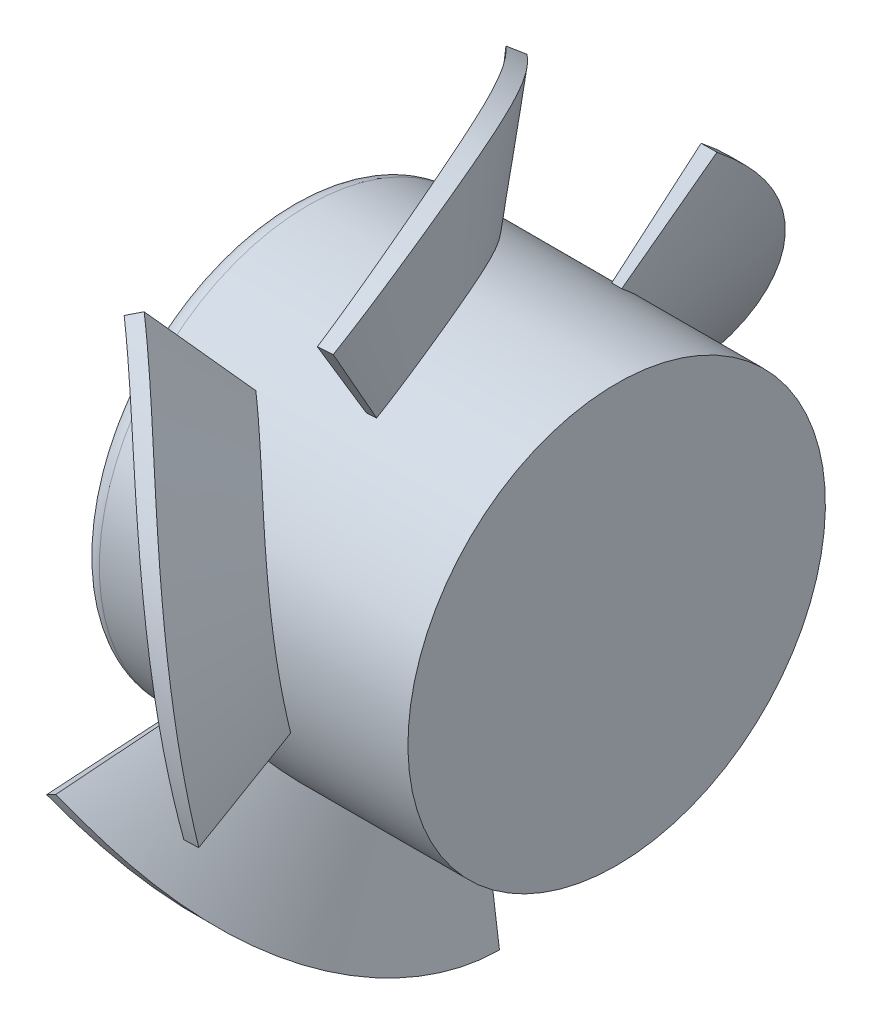
from build123d import *

# Parameters (mm, degrees)
SKETCH5_W                  = 18
SKETCH5_H                  = 11.5
CIRPATTERN1_COUNT          = 5
SKETCH_CUT_BLADE_OUTSIDE_W = 55.323
SKETCH_CUT_BLADE_OUTSIDE_H = 53.609
SKETCH_CUT_BLADE_OUTSIDE_R = 18
CUT_FAN_BLADE_DEPTH        = 37.063855847
COSMETIC_FILLET_R          = 1


with BuildPart() as part:
    # Sketch5 → Body (revolve)
    with BuildSketch(Plane.XY, mode=Mode.PRIVATE) as body_sk:
        with Locations((-11, 5.75)):
            Rectangle(SKETCH5_W, SKETCH5_H)
    revolve(body_sk.sketch.rotate(Axis((-20, 0, 0), (1, 0, 0)), 180), axis=Axis((-20, 0, 0), (1, 0, 0)))

    # Sketch-Blade-Top → Loft-Fan-Blade section 0
    with BuildSketch(Plane(origin=(0, 18, 0), x_dir=(-1, 0, 0), z_dir=(0, 1, 0)), mode=Mode.PRIVATE) as loft_fan_blade_s0:
        with BuildLine():
            Line((8.010742329, 11.989257671), (7.013178279, 11.919501197))
            ThreePointArc((7.013178279, 11.919501197), (10.086454542, -0.406736643), (17.190211201, -10.938488995))
            Line((17.190211201, -10.938488995), (17.909551002, -10.243830625))
            ThreePointArc((17.909551002, -10.243830625), (11, 0), (8.010742329, 11.989257671))
        make_face()
    loft_fan_blade = loft([loft_fan_blade_s0.sketch, Vertex(-11, 0, 0)])

    # CirPattern1: Loft-Fan-Blade ×5 about axis
    cirpattern1_axis = Axis((-20, 0, 0), (1, 0, 0))
    for i in range(1, CIRPATTERN1_COUNT):
        add(loft_fan_blade.rotate(cirpattern1_axis, i * 360 / CIRPATTERN1_COUNT))

    # Sketch-Cut-Blade outside → Cut-Fan-Blade (cut, through all)
    with BuildSketch(Plane(origin=(0, 0, 0), x_dir=(0, 0, -1), z_dir=(1, 0, 0))):
        with Locations((-0.1625, -1.8045)):
            Rectangle(SKETCH_CUT_BLADE_OUTSIDE_W, SKETCH_CUT_BLADE_OUTSIDE_H)
        Circle(SKETCH_CUT_BLADE_OUTSIDE_R, mode=Mode.SUBTRACT)
    extrude(amount=-CUT_FAN_BLADE_DEPTH, mode=Mode.SUBTRACT)

    # Cosmetic-Fillet
    cosmetic_fillet_edges = [part.edges().sort_by_distance(p)[0] for p in [
        (-20, 11.5, 0),
    ]]
    fillet(cosmetic_fillet_edges, radius=COSMETIC_FILLET_R)


solid = part.part
